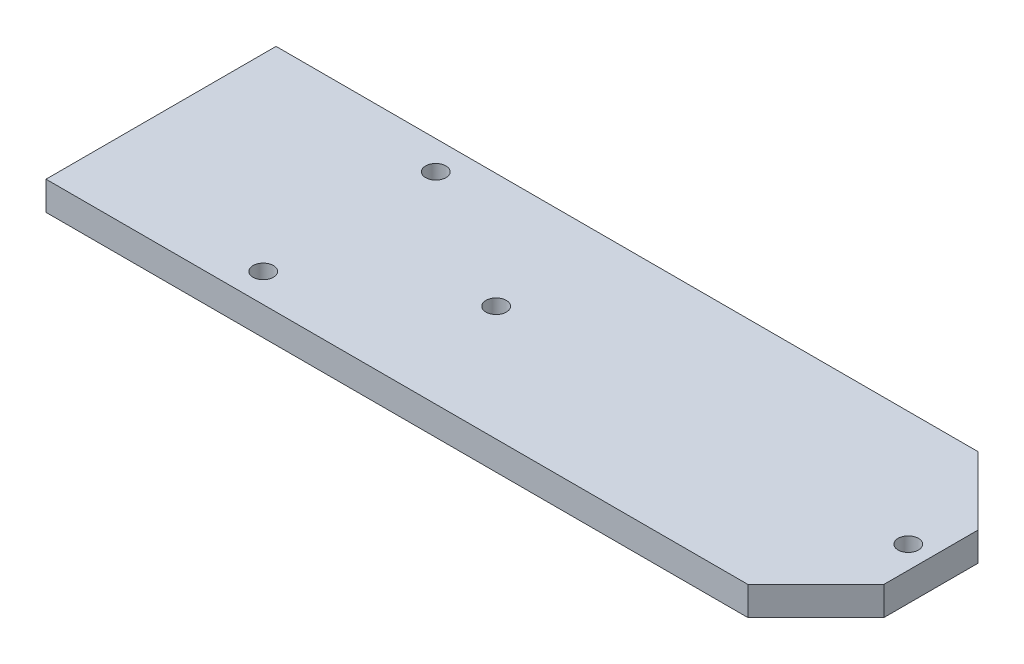
from build123d import *

# Parameters (mm, degrees)
SKETCH1_W                 = 170
SKETCH1_H                 = 50.8
SKETCH1_R                 = 2.25
BOSS_EXTRUDE1_DEPTH       = 6.35
CHAMFER1_SIZE             = 15
M4X0_7_TAPPED_HOLE1_D     = 3.3
M4X0_7_TAPPED_HOLE1_DEPTH = 25.4
M4X0_7_TAPPED_HOLE1_TIP   = 0.991420021


with BuildPart() as part:
    # Sketch1 → Boss-Extrude1 (new body)
    with BuildSketch(Plane(origin=(0, 0, 0), x_dir=(1, 0, 0), z_dir=(0, 1, 0))):
        with Locations((85, 25.4)):
            Rectangle(SKETCH1_W, SKETCH1_H)
        with Locations(Location((165, 25.4, 0), (0, 0, 270))):
            Circle(SKETCH1_R, mode=Mode.SUBTRACT)
        with Locations(Location((73.999999882, 25.4, 0), (0, 0, 270))):
            Circle(SKETCH1_R, mode=Mode.SUBTRACT)
        with Locations(Location((41.619, 44.45, 0), (0, 0, 270))):
            Circle(SKETCH1_R, mode=Mode.SUBTRACT)
        with Locations(Location((41.619, 6.35, 0), (0, 0, 270))):
            Circle(SKETCH1_R, mode=Mode.SUBTRACT)
    extrude(amount=BOSS_EXTRUDE1_DEPTH)

    # Chamfer1
    chamfer1_edges = [part.edges().sort_by_distance(p)[0] for p in [
        (170, 3.175, -50.8),
        (170, 3.175, 0),
    ]]
    chamfer(chamfer1_edges, length=CHAMFER1_SIZE)

    # M4x0.7 Tapped Hole1
    with Locations(Plane.ZY):
        with Locations((-42.9, 3.175), (-7.9, 3.175)):
            Hole(M4X0_7_TAPPED_HOLE1_D / 2, depth=M4X0_7_TAPPED_HOLE1_DEPTH)
            with Locations((0, 0, -(M4X0_7_TAPPED_HOLE1_DEPTH + M4X0_7_TAPPED_HOLE1_TIP / 2))):  # 118° drill point
                Cone(0, M4X0_7_TAPPED_HOLE1_D / 2, M4X0_7_TAPPED_HOLE1_TIP, mode=Mode.SUBTRACT)


solid = part.part
